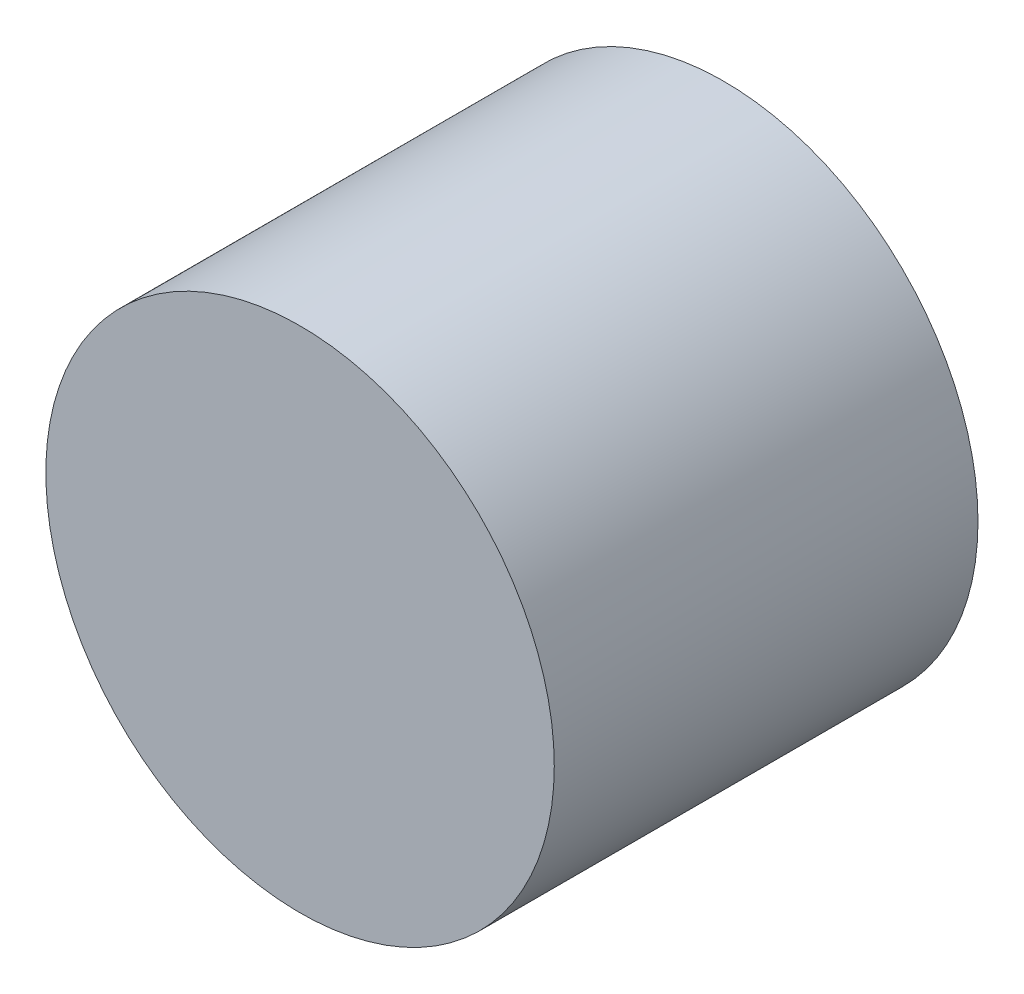
from build123d import *

# Parameters (mm, degrees)
SKETCH1_R           = 4.5
BOSS_EXTRUDE1_DEPTH = 7.5


with BuildPart() as part:
    # Sketch1 → Boss-Extrude1 (new body)
    with BuildSketch(Plane.XY):
        Circle(SKETCH1_R)
    extrude(amount=BOSS_EXTRUDE1_DEPTH)


solid = part.part
